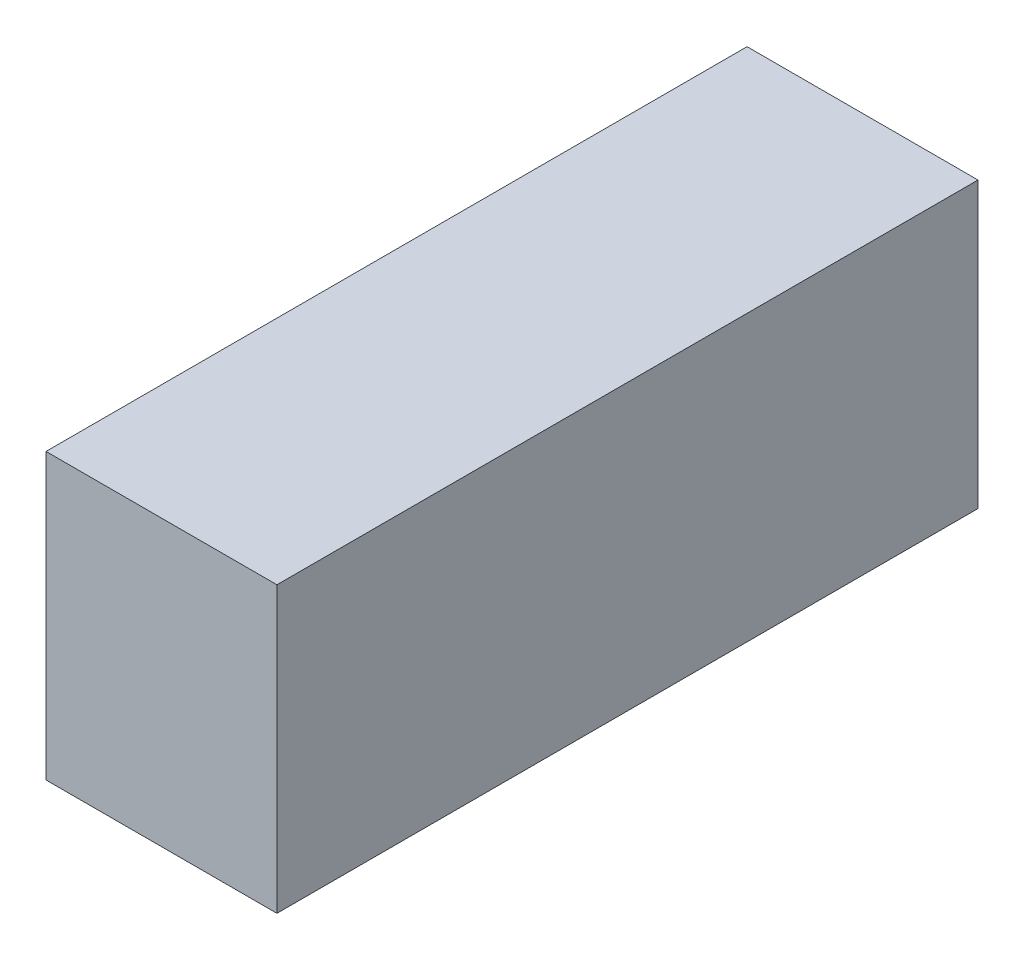
from build123d import *

# Parameters (mm, degrees)
SKIZZE1_W                       = 56
SKIZZE1_H                       = 69
AUFSATZ_LINEAR_AUSTRAGEN1_DEPTH = 170


with BuildPart() as part:
    # Skizze1 → Aufsatz-Linear austragen1 (new body)
    with BuildSketch(Plane.XY):
        Rectangle(SKIZZE1_W, SKIZZE1_H)
    extrude(amount=AUFSATZ_LINEAR_AUSTRAGEN1_DEPTH)


solid = part.part
